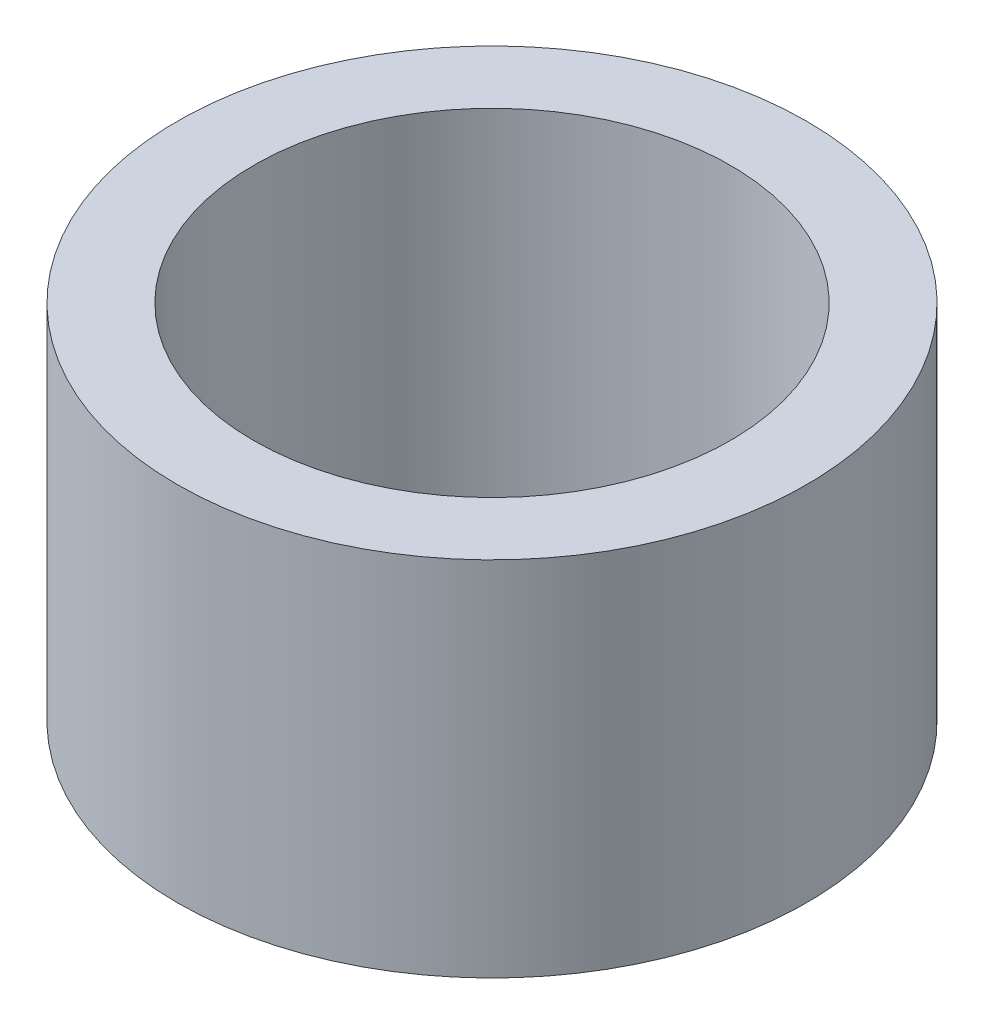
from build123d import *

# Parameters (mm, degrees)
SKETCH1_R           = 18.542
SKETCH1_R_2         = 14.0462
BOSS_EXTRUDE2_DEPTH = 21.336


with BuildPart() as part:
    # Sketch1 → Boss-Extrude2 (new body)
    with BuildSketch(Plane(origin=(0, 0, 0), x_dir=(1, 0, 0), z_dir=(0, 1, 0))):
        with Locations(Location((0, 0, 0), (0, 0, 270))):
            Circle(SKETCH1_R)
        with Locations(Location((0, 0, 0), (0, 0, 270))):
            Circle(SKETCH1_R_2, mode=Mode.SUBTRACT)
    extrude(amount=BOSS_EXTRUDE2_DEPTH)


solid = part.part
